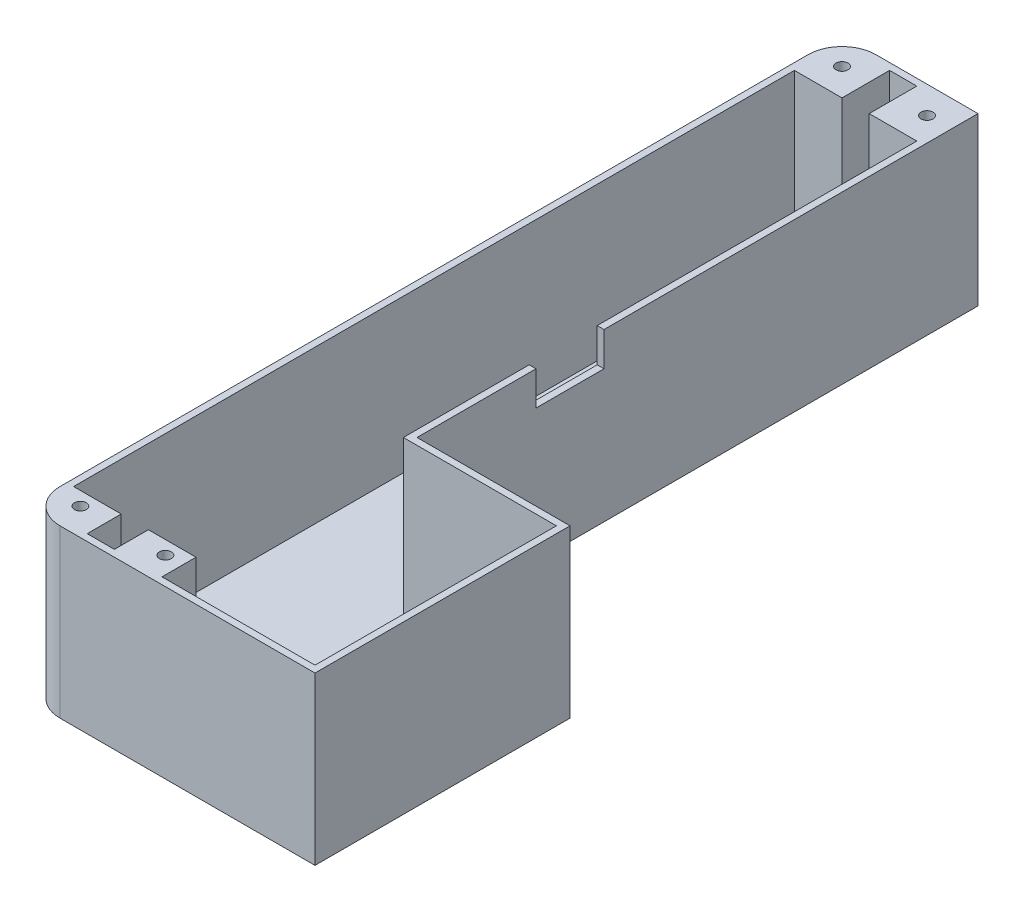
from build123d import *

# Parameters (mm, degrees)
SKETCH1_W           = 40
SKETCH1_H           = 240
BOSS_EXTRUDE2_DEPTH = 4
SKETCH2_W           = 40
SKETCH2_H           = 240
SKETCH2_W_2         = 36
SKETCH2_H_2         = 236
BOSS_EXTRUDE4_DEPTH = 45
SKETCH3_W           = 14
SKETCH3_H           = 14
BOSS_EXTRUDE5_DEPTH = 45
SKETCH4_R           = 1.75
CUT_EXTRUDE1_DEPTH  = 90
FILLET1_R           = 10
FILLET2_R           = 10
SKETCH5_R           = 3.5
CUT_EXTRUDE2_DEPTH  = 45
SKETCH6_W           = 20
SKETCH6_H           = 10
CUT_EXTRUDE3_DEPTH  = 10
SKETCH7_W           = 75
SKETCH7_H           = 49
BOSS_EXTRUDE6_DEPTH = 45
SKETCH8_W           = 45
SKETCH8_H           = 71
CUT_EXTRUDE4_DEPTH  = 45
SKETCH9_W           = 36
SKETCH9_H           = 4
CUT_EXTRUDE5_DEPTH  = 50


with BuildPart() as part:
    # Sketch1 → Boss-Extrude2 (new body)
    with BuildSketch(Plane(origin=(0, 0, 0), x_dir=(1, 0, 0), z_dir=(0, 1, 0))):
        Rectangle(SKETCH1_W, SKETCH1_H)
    extrude(amount=BOSS_EXTRUDE2_DEPTH)

    # Sketch2 → Boss-Extrude4 (add)
    with BuildSketch(Plane(origin=(0, 4, 0), x_dir=(1, 0, 0), z_dir=(0, 1, 0))):
        Rectangle(SKETCH2_W, SKETCH2_H)
        Rectangle(SKETCH2_W_2, SKETCH2_H_2, mode=Mode.SUBTRACT)
    extrude(amount=BOSS_EXTRUDE4_DEPTH)

    # Sketch3 → Boss-Extrude5 (add)
    with BuildSketch(Plane(origin=(0, 4, 0), x_dir=(1, 0, 0), z_dir=(0, 1, 0))):
        with Locations((-11, 111)):
            Rectangle(SKETCH3_W, SKETCH3_H)
        with Locations((11, 111)):
            Rectangle(SKETCH3_W, SKETCH3_H)
        with Locations((-11, -111)):
            Rectangle(SKETCH3_W, SKETCH3_H)
        with Locations((11, -111)):
            Rectangle(SKETCH3_W, SKETCH3_H)
    extrude(amount=BOSS_EXTRUDE5_DEPTH)

    # Sketch4 → Cut-Extrude1 (cut)
    with BuildSketch(Plane(origin=(0, 0, 0), x_dir=(-1, 0, 0), z_dir=(0, -1, 0))):
        with Locations(Location((12, -112, 0), (0, 0, 90))):
            Circle(SKETCH4_R)
        with Locations(Location((-13, -112, 0), (0, 0, 90))):
            Circle(SKETCH4_R)
        with Locations(Location((12, 112, 0), (0, 0, 90))):
            Circle(SKETCH4_R)
        with Locations(Location((-13, 112, 0), (0, 0, 90))):
            Circle(SKETCH4_R)
    extrude(amount=-CUT_EXTRUDE1_DEPTH, mode=Mode.SUBTRACT)

    # Fillet1
    fillet1_edges = [part.edges().sort_by_distance(p)[0] for p in [
        (-20, 24.5, -120),
    ]]
    fillet(fillet1_edges, radius=FILLET1_R)

    # Fillet2
    fillet2_edges = [part.edges().sort_by_distance(p)[0] for p in [
        (-20, 24.5, 120),
    ]]
    fillet(fillet2_edges, radius=FILLET2_R)

    # Sketch5 → Cut-Extrude2 (cut)
    with BuildSketch(Plane(origin=(0, 0, 0), x_dir=(-1, 0, 0), z_dir=(0, -1, 0))):
        with Locations(Location((12, -112, 0), (0, 0, 90))):
            Circle(SKETCH5_R)
        with Locations(Location((-13, -112, 0), (0, 0, 90))):
            Circle(SKETCH5_R)
        with Locations(Location((12, 112, 0), (0, 0, 90))):
            Circle(SKETCH5_R)
        with Locations(Location((-13, 112, 0), (0, 0, 90))):
            Circle(SKETCH5_R)
    extrude(amount=-CUT_EXTRUDE2_DEPTH, mode=Mode.SUBTRACT)

    # Sketch6 → Cut-Extrude3 (cut)
    with BuildSketch(Plane(origin=(20, 0, 0), x_dir=(0, 0, -1), z_dir=(1, 0, 0))):
        with Locations((0, 44)):
            Rectangle(SKETCH6_W, SKETCH6_H)
    extrude(amount=-CUT_EXTRUDE3_DEPTH, mode=Mode.SUBTRACT)

    # Sketch7 → Boss-Extrude6 (add)
    with BuildSketch(Plane(origin=(20, 0, 0), x_dir=(0, 0, -1), z_dir=(1, 0, 0))):
        with Locations((-82.5, 24.5)):
            Rectangle(SKETCH7_W, SKETCH7_H)
    extrude(amount=BOSS_EXTRUDE6_DEPTH)

    # Sketch8 → Cut-Extrude4 (cut)
    with BuildSketch(Plane(origin=(0, 49, 0), x_dir=(1, 0, 0), z_dir=(0, 1, 0))):
        with Locations((40.5, -82.5)):
            Rectangle(SKETCH8_W, SKETCH8_H)
    extrude(amount=-CUT_EXTRUDE4_DEPTH, mode=Mode.SUBTRACT)

    # Sketch9 → Cut-Extrude5 (cut)
    with BuildSketch(Plane(origin=(0, 49, 0), x_dir=(1, 0, 0), z_dir=(0, 1, 0))):
        with Locations((0, -106)):
            Rectangle(SKETCH9_W, SKETCH9_H)
    extrude(amount=-CUT_EXTRUDE5_DEPTH, mode=Mode.SUBTRACT)


solid = part.part
